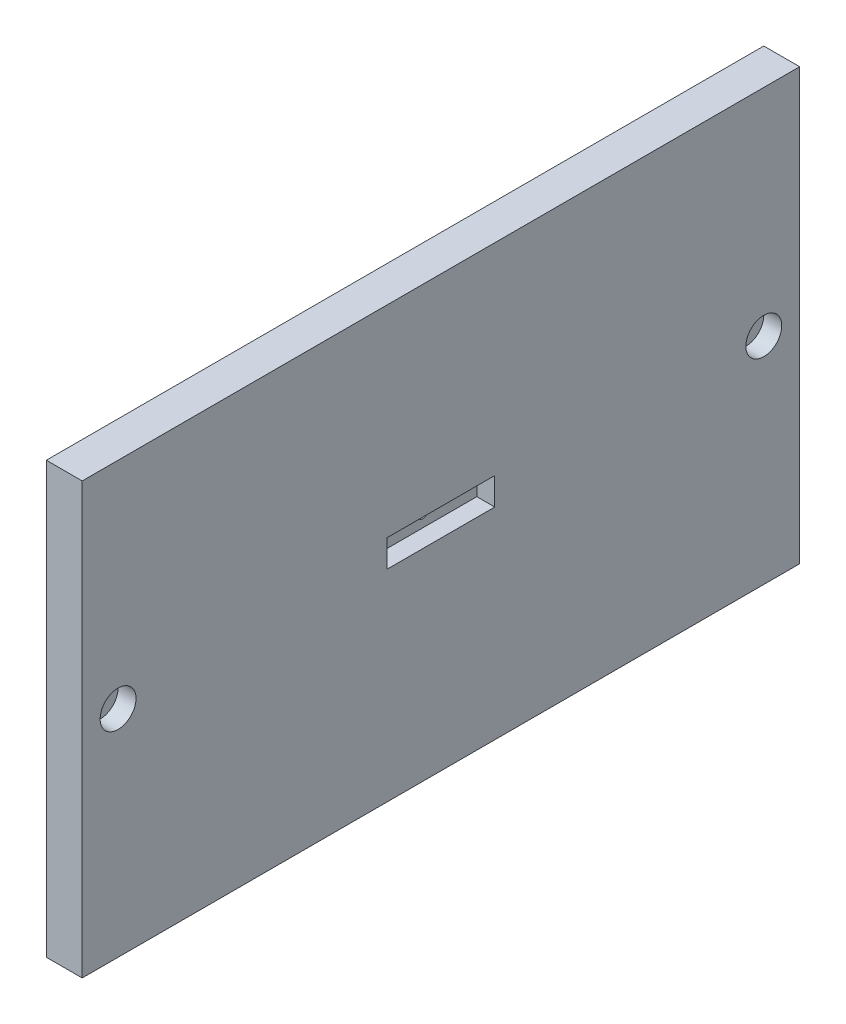
from build123d import *

# Parameters (mm, degrees)
SKETCH1_W                       = 254
SKETCH1_H                       = 152.4
BOSS_EXTRUDE1_DEPTH             = 12.7
SKETCH3_R                       = 6.35
CUT_EXTRUDE2_DEPTH              = 6.35
F_1_4_0_25_DIAMETER_HOLE1_D     = 6.35
F_1_4_0_25_DIAMETER_HOLE1_DEPTH = 12.7
F_1_4_0_25_DIAMETER_HOLE1_TIP   = 1.907732465
SKETCH7_W                       = 38.1
SKETCH7_H                       = 9.652
CUT_EXTRUDE3_DEPTH              = 6.35


with BuildPart() as part:
    # Sketch1 → Boss-Extrude1 (new body)
    with BuildSketch(Plane(origin=(0, 0, 0), x_dir=(0, 0, -1), z_dir=(1, 0, 0))):
        Rectangle(SKETCH1_W, SKETCH1_H)
    extrude(amount=BOSS_EXTRUDE1_DEPTH)

    # Sketch3 → Cut-Extrude2 (cut)
    with BuildSketch(Plane(origin=(12.7, 0, 0), x_dir=(0, 0, -1), z_dir=(1, 0, 0))):
        with Locations((114.3, 0)):
            Circle(SKETCH3_R)
        with Locations((-114.3, 0)):
            Circle(SKETCH3_R)
    extrude(amount=-CUT_EXTRUDE2_DEPTH, mode=Mode.SUBTRACT)

    # 1/4 (0.25) Diameter Hole1
    with Locations(Plane(origin=(0, -76.2, 0), x_dir=(-1, 0, 0), z_dir=(0, -1, 0))):
        with Locations((-6.236337014, -114.3), (-6.236337014, 0), (-6.236337014, 114.3)):
            Hole(F_1_4_0_25_DIAMETER_HOLE1_D / 2, depth=F_1_4_0_25_DIAMETER_HOLE1_DEPTH)
            with Locations((0, 0, -(F_1_4_0_25_DIAMETER_HOLE1_DEPTH + F_1_4_0_25_DIAMETER_HOLE1_TIP / 2))):  # 118° drill point
                Cone(0, F_1_4_0_25_DIAMETER_HOLE1_D / 2, F_1_4_0_25_DIAMETER_HOLE1_TIP, mode=Mode.SUBTRACT)

    # Sketch7 → Cut-Extrude3 (cut)
    with BuildSketch(Plane(origin=(12.7, 0, 0), x_dir=(0, 0, -1), z_dir=(1, 0, 0))):
        Rectangle(SKETCH7_W, SKETCH7_H)
    extrude(amount=-CUT_EXTRUDE3_DEPTH, mode=Mode.SUBTRACT)

    # Sketch10 → #10-32 Tapped Hole1 (revolve, cut)
    with BuildSketch(Plane(origin=(6.35, 0, 0), x_dir=(0, 0, -1), z_dir=(0, 1, 0))):
        Polygon((0, 0), (0, 6.35), (2.6543, 6.35), (2.0193, 5.715), (2.0193, 0), align=None)
    revolve(axis=Axis((12.7, 0, 0), (-1, 0, 0)), mode=Mode.SUBTRACT)


solid = part.part
